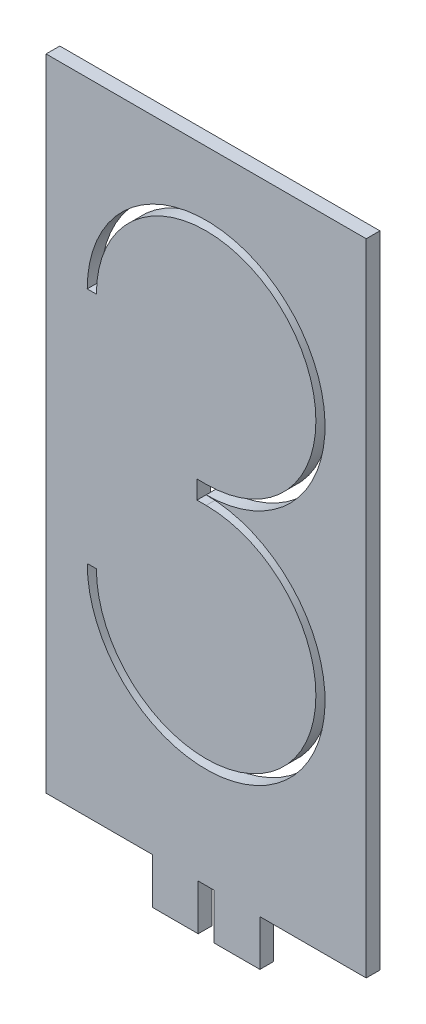
from build123d import *

# Parameters (mm, degrees)
SKIZZE1_W                       = 35
SKIZZE1_H                       = 75
AUFSATZ_LINEAR_AUSTRAGEN1_DEPTH = 1.5
SKIZZE2_W                       = 11.63
SKIZZE2_H                       = 5
SKIZZE2_W_2                     = 11.62
SKIZZE2_W_3                     = 1.75
SCHNITT_LINEAR_AUSTRAGEN1_DEPTH = 1.5
SCHNITT_LINEAR_AUSTRAGEN4_DEPTH = 20


with BuildPart() as part:
    # Skizze1 → Aufsatz-Linear austragen1 (new body)
    with BuildSketch(Plane.XY):
        with Locations((17.5, 37.5)):
            Rectangle(SKIZZE1_W, SKIZZE1_H)
    extrude(amount=AUFSATZ_LINEAR_AUSTRAGEN1_DEPTH)

    # Skizze2 → Schnitt-Linear austragen1 (cut)
    with BuildSketch(Plane.XY.offset(1.5)):
        with Locations((5.815, 2.5)):
            Rectangle(SKIZZE2_W, SKIZZE2_H)
        with Locations((29.19, 2.5)):
            Rectangle(SKIZZE2_W_2, SKIZZE2_H)
        with Locations((17.505, 2.5)):
            Rectangle(SKIZZE2_W_3, SKIZZE2_H)
    extrude(amount=-SCHNITT_LINEAR_AUSTRAGEN1_DEPTH, mode=Mode.SUBTRACT)

    # Skizze9 → Schnitt-Linear austragen4 (cut)
    with BuildSketch(Plane.XY.offset(1.5)):
        with BuildLine():
            Line((5.5, 55), (4.5, 55))
            ThreePointArc((4.5, 55), (26.692388155, 64.192388155), (17.5, 42))
            ThreePointArc((17.5, 42), (26.692388155, 19.807611845), (4.5, 29))
            Line((4.5, 29), (5.5, 29))
            ThreePointArc((5.5, 29), (25.985281374, 20.514718626), (17.5, 41))
            Line((17.5, 41), (16.5, 41))
            Line((16.5, 41), (16.5, 43))
            Line((16.5, 43), (17.5, 43))
            ThreePointArc((17.5, 43), (25.985281374, 63.485281374), (5.5, 55))
        make_face()
    extrude(amount=-SCHNITT_LINEAR_AUSTRAGEN4_DEPTH, mode=Mode.SUBTRACT)


solid = part.part
